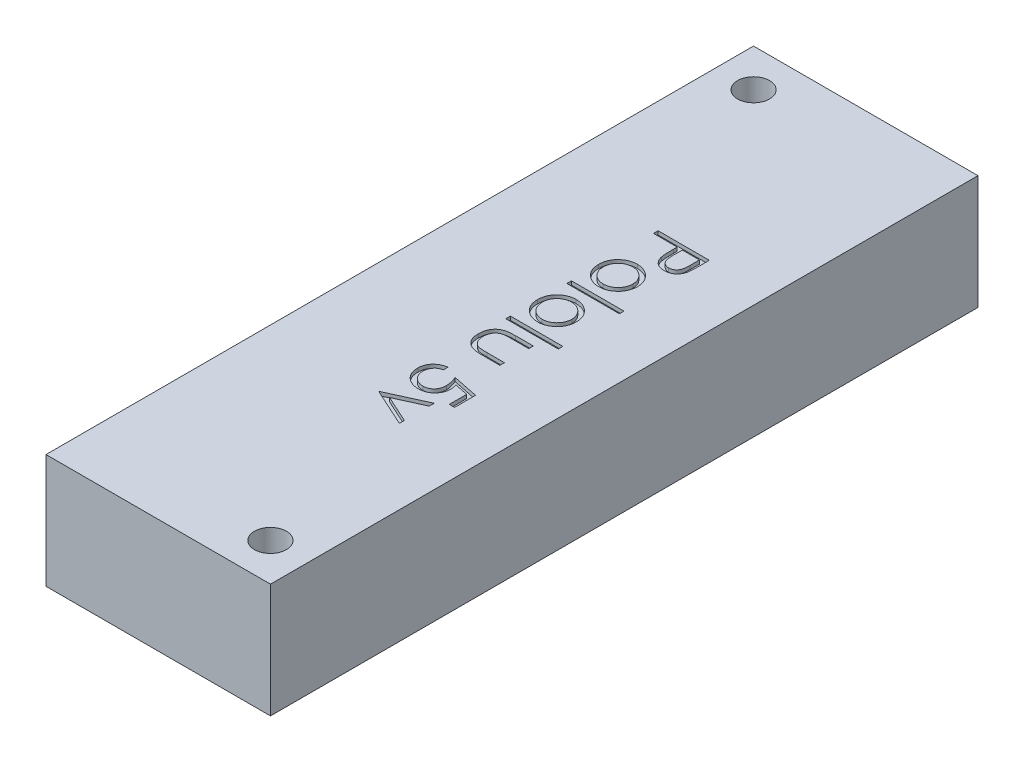
from build123d import *

# Parameters (mm, degrees)
SKETCH1_W           = 15.340000054
SKETCH1_H           = 48.35
BOSS_EXTRUDE1_DEPTH = 7.8
SKETCH3_R           = 1.0922
CUT_EXTRUDE1_DEPTH  = 27.534873759
SKETCH5_W           = 3.58974359
SKETCH5_H           = 0.314102564
CUT_EXTRUDE3_DEPTH  = 0.254


with BuildPart() as part:
    # Sketch1 → Boss-Extrude1 (new body)
    with BuildSketch(Plane(origin=(0, 0, 0), x_dir=(1, 0, 0), z_dir=(0, 1, 0))):
        Rectangle(SKETCH1_W, SKETCH1_H)
    extrude(amount=BOSS_EXTRUDE1_DEPTH)

    # Sketch3 → Cut-Extrude1 (cut, through all)
    with BuildSketch(Plane(origin=(0, 7.8, 0), x_dir=(1, 0, 0), z_dir=(0, 1, 0))):
        with Locations(Location((-5.08, 21.59, 0), (0, 0, 270))):
            Circle(SKETCH3_R)
        with Locations(Location((5.08, -21.59, 0), (0, 0, 270))):
            Circle(SKETCH3_R)
    extrude(amount=-CUT_EXTRUDE1_DEPTH, mode=Mode.SUBTRACT)

    # Sketch5 → Cut-Extrude3 (cut)
    # profile 1 of 8: a face of its own
    with BuildSketch(Plane(origin=(0, 7.8, 0), x_dir=(1, 0, 0), z_dir=(0, 1, 0))):
        with BuildLine():
            Line((3.5, 9.983974359), (3.5, 9.297576122))
            add(Edge.make_bspline(
                [(3.5, 9.297576122), (3.499948104, 9.250365216), (3.499848668, 9.159907023), (3.496833922, 9.030191967), (3.49280723, 8.912382235), (3.487225337, 8.806731855), (3.480628747, 8.712915756), (3.471376708, 8.631358457), (3.461716412, 8.561418901), (3.451895005, 8.519512451), (3.447415865, 8.500400641)],
                knots=[0, 0, 0, 0, 1.415646017, 2.712440637, 3.8905458, 4.950247383, 5.884950622, 6.709939814, 7.411656543, 8, 8, 8, 8], degree=3))
            add(Edge.make_bspline(
                [(3.447415865, 8.500400641), (3.440793975, 8.47620705), (3.42770623, 8.42838996), (3.401491651, 8.359489743), (3.370412659, 8.29393283), (3.334976989, 8.231512612), (3.293734792, 8.172928604), (3.247990678, 8.117430894), (3.197769812, 8.064701161), (3.142098627, 8.016530618), (3.083029703, 7.972183449), (3.019247543, 7.934140306), (2.952140341, 7.901960829), (2.881020836, 7.875679998), (2.806321276, 7.855696428), (2.727823588, 7.840931936), (2.645797497, 7.83148543), (2.589736435, 7.830586047), (2.561197917, 7.830128205)],
                knots=[0, 0, 0, 0, 0.999487232, 1.975422798, 2.933948774, 3.889618007, 4.832992075, 5.786114792, 6.754729845, 7.731954186, 8.717668599, 9.695514499, 10.68728626, 11.680675814, 12.71351902, 13.766008651, 14.862761406, 16, 16, 16, 16], degree=3))
            add(Edge.make_bspline(
                [(2.561197917, 7.830128205), (2.53242014, 7.83054963), (2.476114476, 7.831374176), (2.393741688, 7.841270461), (2.315023298, 7.854600653), (2.240133847, 7.875097705), (2.169518077, 7.901943378), (2.102096845, 7.933435431), (2.039017173, 7.971418961), (1.980050055, 8.015063791), (1.925140143, 8.063615385), (1.874685348, 8.116868324), (1.82898101, 8.174607616), (1.787924666, 8.236649764), (1.752468387, 8.303599613), (1.720711082, 8.374441767), (1.694040021, 8.449791983), (1.68000996, 8.501934497), (1.672876603, 8.528445513)],
                knots=[0, 0, 0, 0, 1.121902311, 2.195077645, 3.232258892, 4.234102512, 5.217864754, 6.176164875, 7.132989551, 8.084763148, 9.034132444, 9.988522005, 10.94243251, 11.903244335, 12.886203696, 13.894208494, 14.929344452, 16, 16, 16, 16], degree=3))
            add(Edge.make_bspline(
                [(1.672876603, 8.528445513), (1.668213621, 8.550372847), (1.657994427, 8.598427874), (1.64658597, 8.677570596), (1.63684837, 8.769715982), (1.629547232, 8.874738262), (1.623296864, 8.992543167), (1.61832877, 9.123194424), (1.615598916, 9.266948502), (1.615458123, 9.367219746), (1.615384615, 9.419571314)],
                knots=[0, 0, 0, 0, 0.601384939, 1.31797006, 2.144135048, 3.087295005, 4.142315834, 5.309527816, 6.595305764, 8, 8, 8, 8], degree=3))
            Line((1.615384615, 9.419571314), (1.615384615, 9.669871795))
            Line((1.615384615, 9.669871795), (0, 9.669871795))
            Line((0, 9.669871795), (0, 9.983974359))
            Line((0, 9.983974359), (3.5, 9.983974359))
        make_face()
        with BuildLine():
            Line((3.141025641, 9.669871795), (1.974358974, 9.669871795))
            Line((1.974358974, 9.669871795), (1.966646635, 9.057091346))
            add(Edge.make_bspline(
                [(1.966646635, 9.057091346), (1.966627924, 9.027171128), (1.966591804, 8.969410763), (1.970631709, 8.885745433), (1.975087995, 8.808322435), (1.982066731, 8.736973633), (1.99126187, 8.672244279), (2.001270604, 8.613302947), (2.014830447, 8.561012507), (2.033737491, 8.499737685), (2.065355346, 8.431690589), (2.112432024, 8.358154058), (2.170792088, 8.294824116), (2.237310672, 8.240387276), (2.311578922, 8.19819887), (2.390418136, 8.166467809), (2.473877922, 8.147984649), (2.530961719, 8.145490569), (2.559795673, 8.144230769)],
                knots=[0, 0, 0, 0, 1.160368111, 2.240066715, 3.248291599, 4.168343349, 5.019594299, 5.784185847, 6.485545725, 7.113397927, 8.269509094, 9.383373363, 10.487084095, 11.595623793, 12.704274681, 13.786671823, 14.88201193, 16, 16, 16, 16], degree=3))
            add(Edge.make_bspline(
                [(2.559795673, 8.144230769), (2.587932, 8.145497297), (2.643863535, 8.148014996), (2.725874557, 8.166613603), (2.803877317, 8.198136928), (2.877231232, 8.240673151), (2.943477588, 8.293546936), (3.000520555, 8.355473427), (3.047000556, 8.425188127), (3.076793746, 8.490071313), (3.095014888, 8.547667384), (3.107758306, 8.597700584), (3.117934363, 8.654190866), (3.126173726, 8.717158766), (3.133227231, 8.786115563), (3.138013195, 8.861653889), (3.140814655, 8.943487529), (3.14095361, 9.0002981), (3.141025641, 9.029747596)],
                knots=[0, 0, 0, 0, 1.120550889, 2.227516482, 3.330715807, 4.461473166, 5.594337325, 6.694900473, 7.802844763, 8.919519911, 9.52614448, 10.208195984, 10.975273469, 11.811520316, 12.738076669, 13.736566072, 14.826679847, 16, 16, 16, 16], degree=3))
            Line((3.141025641, 9.029747596), (3.141025641, 9.669871795))
        make_face(mode=Mode.SUBTRACT)
    # profile 2 of 8: a face of its own
    with BuildSketch(Plane(origin=(0, 7.8, 0), x_dir=(1, 0, 0), z_dir=(0, 1, 0))):
        with BuildLine():
            add(Edge.make_bspline(
                [(2.602564103, 5.966546474), (2.60154521, 5.91855401), (2.599547412, 5.824452517), (2.57808998, 5.686661501), (2.545551155, 5.555267773), (2.499748526, 5.429707695), (2.439653687, 5.311019901), (2.366981145, 5.198144705), (2.281239229, 5.091308256), (2.214875573, 5.027287897), (2.181189904, 4.994791667)],
                knots=[0, 0, 0, 0, 1.054042676, 2.066720093, 3.05716247, 4.025731183, 4.997454851, 5.974904663, 6.97207755, 8, 8, 8, 8], degree=3))
            add(Edge.make_bspline(
                [(2.181189904, 4.994791667), (2.148975918, 4.966809713), (2.085171376, 4.911387332), (1.981715763, 4.840321614), (1.874575662, 4.779100053), (1.762328336, 4.730037092), (1.645953664, 4.691352069), (1.525051653, 4.663886372), (1.399889306, 4.647549438), (1.314885468, 4.645346471), (1.271834936, 4.644230769)],
                knots=[0, 0, 0, 0, 1.025258237, 2.030674902, 3.01204498, 3.988269485, 4.97094183, 5.956517959, 6.965070386, 8, 8, 8, 8], degree=3))
            add(Edge.make_bspline(
                [(1.271834936, 4.644230769), (1.228534878, 4.645212107), (1.142971945, 4.647151275), (1.01695258, 4.665494892), (0.894757754, 4.694025976), (0.776899073, 4.73485782), (0.663016196, 4.787215907), (0.553606839, 4.851106681), (0.448453965, 4.926977963), (0.348454996, 5.012983259), (0.25627808, 5.108030289), (0.175988565, 5.211163987), (0.106912047, 5.320432366), (0.052046085, 5.437327047), (0.007820299, 5.560184074), (-0.022676228, 5.689784892), (-0.041279936, 5.826013887), (-0.043657667, 5.919043343), (-0.044871795, 5.966546474)],
                knots=[0, 0, 0, 0, 0.998669827, 1.973418153, 2.932281609, 3.89081133, 4.846438734, 5.82045571, 6.809776312, 7.834649874, 8.860672198, 9.859676908, 10.845817165, 11.837296335, 12.833502054, 13.853824644, 14.904110009, 16, 16, 16, 16], degree=3))
            add(Edge.make_bspline(
                [(-0.044871795, 5.966546474), (-0.043647621, 6.014280058), (-0.041250016, 6.107768694), (-0.022814613, 6.244510649), (0.008146141, 6.374657127), (0.05149858, 6.498095295), (0.107362699, 6.614989503), (0.175719795, 6.724661357), (0.256318736, 6.8278437), (0.34844398, 6.92292053), (0.448456803, 7.008917836), (0.553606102, 7.08479118), (0.663016387, 7.148681419), (0.776899022, 7.201039645), (0.894757767, 7.241871452), (1.016952576, 7.270402546), (1.142971946, 7.288746161), (1.228534878, 7.290685329), (1.271834936, 7.291666667)],
                knots=[0, 0, 0, 0, 1.099861214, 2.154133753, 3.1731438, 4.178222029, 5.163564916, 6.153006591, 7.15072618, 8.175428628, 9.198983792, 10.187031731, 11.15979573, 12.114193814, 13.071490482, 14.029120454, 15.002614863, 16, 16, 16, 16], degree=3))
            add(Edge.make_bspline(
                [(1.271834936, 7.291666667), (1.314651482, 7.290543356), (1.399420884, 7.288319395), (1.524347945, 7.271998886), (1.645045334, 7.244640329), (1.76097081, 7.205908933), (1.872726246, 7.156393742), (1.980131077, 7.096032454), (2.083118877, 7.024241821), (2.146840957, 6.96903987), (2.179086538, 6.941105769)],
                knots=[0, 0, 0, 0, 1.031353054, 2.041901799, 3.029428768, 4.008703097, 4.981709435, 5.96992636, 6.972712378, 8, 8, 8, 8], degree=3))
            add(Edge.make_bspline(
                [(2.179086538, 6.941105769), (2.213058664, 6.908655841), (2.279870826, 6.844837349), (2.365443569, 6.737507728), (2.439095912, 6.625118081), (2.499160507, 6.50566471), (2.54546805, 6.379755503), (2.578241849, 6.247385231), (2.5994525, 6.109092684), (2.601516565, 6.014535411), (2.602564103, 5.966546474)],
                knots=[0, 0, 0, 0, 1.027951202, 2.021646915, 2.998468564, 3.9668038, 4.943370589, 5.93035926, 6.949632805, 8, 8, 8, 8], degree=3))
        make_face()
        with BuildLine():
            add(Edge.make_bspline(
                [(2.288461538, 5.967948718), (2.287496895, 6.001886291), (2.285592509, 6.068885345), (2.271109357, 6.167505479), (2.24815907, 6.2624436), (2.215565273, 6.353891941), (2.173427645, 6.441496812), (2.121963898, 6.525354603), (2.060899931, 6.605240019), (1.991449449, 6.680539367), (1.916014047, 6.750456766), (1.834897943, 6.810870902), (1.750428202, 6.862337016), (1.662166361, 6.905166387), (1.56927654, 6.93707648), (1.472795205, 6.960248715), (1.372529979, 6.974719168), (1.304368935, 6.976605517), (1.269731571, 6.977564103)],
                knots=[0, 0, 0, 0, 1.021589593, 2.016807015, 2.994807536, 3.958602519, 4.934347097, 5.916793557, 6.916107818, 7.957073844, 8.998039869, 10.008589932, 10.997041759, 11.972786337, 12.956492182, 13.948170289, 14.957322718, 16, 16, 16, 16], degree=3))
            add(Edge.make_bspline(
                [(1.269731571, 6.977564103), (1.224977566, 6.975961519), (1.136149235, 6.97278069), (1.005367193, 6.946783104), (0.879576721, 6.903599903), (0.760292369, 6.84405316), (0.64973484, 6.770719555), (0.550320988, 6.684970944), (0.465884611, 6.585621823), (0.394872197, 6.476055219), (0.338949987, 6.357823832), (0.298846326, 6.23290986), (0.273127506, 6.102450683), (0.270541049, 6.013175087), (0.269230769, 5.967948718)],
                knots=[0, 0, 0, 0, 1.016977094, 2.018509362, 3.018404954, 4.033172147, 5.041280572, 6.028085189, 7.007940189, 7.995502847, 8.989109012, 9.972200833, 10.97273166, 12, 12, 12, 12], degree=3))
            add(Edge.make_bspline(
                [(0.269230769, 5.967948718), (0.270533459, 5.922719748), (0.273104934, 5.833439016), (0.298976626, 5.702798322), (0.338775602, 5.577542001), (0.394935358, 5.459187683), (0.465616203, 5.349571183), (0.550802015, 5.250931483), (0.649473499, 5.164444416), (0.760145777, 5.091038197), (0.879762163, 5.032450918), (1.005344015, 4.989064638), (1.136155138, 4.963129401), (1.224979543, 4.959940157), (1.269731571, 4.958333333)],
                knots=[0, 0, 0, 0, 1.027082318, 2.027431966, 3.015401697, 4.008827937, 4.996211763, 5.971861488, 6.96198607, 7.969911943, 8.982141629, 9.981856156, 10.983207064, 12, 12, 12, 12], degree=3))
            add(Edge.make_bspline(
                [(1.269731571, 4.958333333), (1.3043717, 4.959284786), (1.372538187, 4.9611571), (1.472763828, 4.975729641), (1.569467367, 4.998541916), (1.661792021, 5.031849361), (1.750859277, 5.073208803), (1.834644294, 5.12592689), (1.916065613, 5.18605963), (1.991403982, 5.256105325), (2.061153687, 5.331396196), (2.121741455, 5.411881755), (2.173457034, 5.495778492), (2.215570463, 5.583411049), (2.248033616, 5.674652447), (2.271209332, 5.76930233), (2.285539702, 5.867485728), (2.287481364, 5.934246873), (2.288461538, 5.967948718)],
                knots=[0, 0, 0, 0, 1.043020522, 2.052505155, 3.044509714, 4.030878336, 5.003918577, 5.996372628, 7.007255355, 8.048564058, 9.08987276, 10.095126797, 11.077896669, 12.053962454, 13.01807471, 13.98956039, 14.985105429, 16, 16, 16, 16], degree=3))
        make_face(mode=Mode.SUBTRACT)
    # profile 3 of 8: a face of its own
    with BuildSketch(Plane(origin=(0, 7.8, 0), x_dir=(1, 0, 0), z_dir=(0, 1, 0))):
        with Locations((1.794871795, 3.903846154)):
            Rectangle(SKETCH5_W, SKETCH5_H)
    # profile 4 of 8: a face of its own
    with BuildSketch(Plane(origin=(0, 7.8, 0), x_dir=(1, 0, 0), z_dir=(0, 1, 0))):
        with BuildLine():
            add(Edge.make_bspline(
                [(2.602564103, 1.793469551), (2.60154521, 1.745477087), (2.599547412, 1.651375594), (2.57808998, 1.513584578), (2.545551155, 1.38219085), (2.499748526, 1.256630772), (2.439653687, 1.137942978), (2.366981145, 1.025067781), (2.281239229, 0.918231333), (2.214875573, 0.854210974), (2.181189904, 0.821714744)],
                knots=[0, 0, 0, 0, 1.054042676, 2.066720093, 3.05716247, 4.025731183, 4.997454851, 5.974904663, 6.97207755, 8, 8, 8, 8], degree=3))
            add(Edge.make_bspline(
                [(2.181189904, 0.821714744), (2.148975918, 0.79373279), (2.085171376, 0.738310409), (1.981715763, 0.66724469), (1.874575662, 0.60602313), (1.762328336, 0.556960169), (1.645953664, 0.518275146), (1.525051653, 0.490809449), (1.399889306, 0.474472514), (1.314885468, 0.472269548), (1.271834936, 0.471153846)],
                knots=[0, 0, 0, 0, 1.025258237, 2.030674902, 3.01204498, 3.988269485, 4.97094183, 5.956517959, 6.965070386, 8, 8, 8, 8], degree=3))
            add(Edge.make_bspline(
                [(1.271834936, 0.471153846), (1.228534878, 0.472135183), (1.142971945, 0.474074352), (1.01695258, 0.492417969), (0.894757754, 0.520949053), (0.776899073, 0.561780897), (0.663016196, 0.614138983), (0.553606839, 0.678029758), (0.448453965, 0.75390104), (0.348454996, 0.839906336), (0.25627808, 0.934953366), (0.175988565, 1.038087064), (0.106912047, 1.147355443), (0.052046085, 1.264250124), (0.007820299, 1.387107151), (-0.022676228, 1.516707968), (-0.041279936, 1.652936964), (-0.043657667, 1.74596642), (-0.044871795, 1.793469551)],
                knots=[0, 0, 0, 0, 0.998669827, 1.973418153, 2.932281609, 3.89081133, 4.846438734, 5.82045571, 6.809776312, 7.834649874, 8.860672198, 9.859676908, 10.845817165, 11.837296335, 12.833502054, 13.853824644, 14.904110009, 16, 16, 16, 16], degree=3))
            add(Edge.make_bspline(
                [(-0.044871795, 1.793469551), (-0.043647621, 1.841203135), (-0.041250016, 1.934691771), (-0.022814613, 2.071433726), (0.008146141, 2.201580204), (0.05149858, 2.325018372), (0.107362699, 2.44191258), (0.175719795, 2.551584434), (0.256318736, 2.654766777), (0.34844398, 2.749843607), (0.448456803, 2.835840913), (0.553606102, 2.911714256), (0.663016387, 2.975604496), (0.776899022, 3.027962722), (0.894757767, 3.068794529), (1.016952576, 3.097325623), (1.142971946, 3.115669237), (1.228534878, 3.117608406), (1.271834936, 3.118589744)],
                knots=[0, 0, 0, 0, 1.099861214, 2.154133753, 3.1731438, 4.178222029, 5.163564916, 6.153006591, 7.15072618, 8.175428628, 9.198983792, 10.187031731, 11.15979573, 12.114193814, 13.071490482, 14.029120454, 15.002614863, 16, 16, 16, 16], degree=3))
            add(Edge.make_bspline(
                [(1.271834936, 3.118589744), (1.314651482, 3.117466433), (1.399420884, 3.115242472), (1.524347945, 3.098921963), (1.645045334, 3.071563406), (1.76097081, 3.03283201), (1.872726246, 2.983316819), (1.980131077, 2.922955531), (2.083118877, 2.851164898), (2.146840957, 2.795962947), (2.179086538, 2.768028846)],
                knots=[0, 0, 0, 0, 1.031353054, 2.041901799, 3.029428768, 4.008703097, 4.981709435, 5.96992636, 6.972712378, 8, 8, 8, 8], degree=3))
            add(Edge.make_bspline(
                [(2.179086538, 2.768028846), (2.213058664, 2.735578918), (2.279870826, 2.671760425), (2.365443569, 2.564430805), (2.439095912, 2.452041158), (2.499160507, 2.332587787), (2.54546805, 2.20667858), (2.578241849, 2.074308308), (2.5994525, 1.93601576), (2.601516565, 1.841458488), (2.602564103, 1.793469551)],
                knots=[0, 0, 0, 0, 1.027951202, 2.021646915, 2.998468564, 3.9668038, 4.943370589, 5.93035926, 6.949632805, 8, 8, 8, 8], degree=3))
        make_face()
        with BuildLine():
            add(Edge.make_bspline(
                [(2.288461538, 1.794871795), (2.287496895, 1.828809368), (2.285592509, 1.895808422), (2.271109357, 1.994428556), (2.24815907, 2.089366677), (2.215565273, 2.180815018), (2.173427645, 2.268419889), (2.121963898, 2.35227768), (2.060899931, 2.432163096), (1.991449449, 2.507462444), (1.916014047, 2.577379843), (1.834897943, 2.637793979), (1.750428202, 2.689260093), (1.662166361, 2.732089464), (1.56927654, 2.763999557), (1.472795205, 2.787171792), (1.372529979, 2.801642245), (1.304368935, 2.803528594), (1.269731571, 2.804487179)],
                knots=[0, 0, 0, 0, 1.021589593, 2.016807015, 2.994807536, 3.958602519, 4.934347097, 5.916793557, 6.916107818, 7.957073844, 8.998039869, 10.008589932, 10.997041759, 11.972786337, 12.956492182, 13.948170289, 14.957322718, 16, 16, 16, 16], degree=3))
            add(Edge.make_bspline(
                [(1.269731571, 2.804487179), (1.224977566, 2.802884596), (1.136149235, 2.799703767), (1.005367193, 2.773706181), (0.879576721, 2.73052298), (0.760292369, 2.670976237), (0.64973484, 2.597642632), (0.550320988, 2.511894021), (0.465884611, 2.412544899), (0.394872197, 2.302978296), (0.338949987, 2.184746908), (0.298846326, 2.059832937), (0.273127506, 1.92937376), (0.270541049, 1.840098164), (0.269230769, 1.794871795)],
                knots=[0, 0, 0, 0, 1.016977094, 2.018509362, 3.018404954, 4.033172147, 5.041280572, 6.028085189, 7.007940189, 7.995502847, 8.989109012, 9.972200833, 10.97273166, 12, 12, 12, 12], degree=3))
            add(Edge.make_bspline(
                [(0.269230769, 1.794871795), (0.270533459, 1.749642824), (0.273104934, 1.660362093), (0.298976626, 1.529721399), (0.338775602, 1.404465078), (0.394935358, 1.28611076), (0.465616203, 1.17649426), (0.550802015, 1.07785456), (0.649473499, 0.991367493), (0.760145777, 0.917961274), (0.879762163, 0.859373995), (1.005344015, 0.815987715), (1.136155138, 0.790052478), (1.224979543, 0.786863234), (1.269731571, 0.78525641)],
                knots=[0, 0, 0, 0, 1.027082318, 2.027431966, 3.015401697, 4.008827937, 4.996211763, 5.971861488, 6.96198607, 7.969911943, 8.982141629, 9.981856156, 10.983207064, 12, 12, 12, 12], degree=3))
            add(Edge.make_bspline(
                [(1.269731571, 0.78525641), (1.3043717, 0.786207863), (1.372538187, 0.788080177), (1.472763828, 0.802652717), (1.569467367, 0.825464993), (1.661792021, 0.858772438), (1.750859277, 0.90013188), (1.834644294, 0.952849967), (1.916065613, 1.012982707), (1.991403982, 1.083028402), (2.061153687, 1.158319273), (2.121741455, 1.238804832), (2.173457034, 1.322701569), (2.215570463, 1.410334125), (2.248033616, 1.501575524), (2.271209332, 1.596225407), (2.285539702, 1.694408805), (2.287481364, 1.76116995), (2.288461538, 1.794871795)],
                knots=[0, 0, 0, 0, 1.043020522, 2.052505155, 3.044509714, 4.030878336, 5.003918577, 5.996372628, 7.007255355, 8.048564058, 9.08987276, 10.095126797, 11.077896669, 12.053962454, 13.01807471, 13.98956039, 14.985105429, 16, 16, 16, 16], degree=3))
        make_face(mode=Mode.SUBTRACT)
    # profile 5 of 8: a face of its own
    with BuildSketch(Plane(origin=(0, 7.8, 0), x_dir=(1, 0, 0), z_dir=(0, 1, 0))):
        with Locations((1.794871795, -0.269230769)):
            Rectangle(SKETCH5_W, SKETCH5_H)
    # profile 6 of 8: a face of its own
    with BuildSketch(Plane(origin=(0, 7.8, 0), x_dir=(1, 0, 0), z_dir=(0, 1, 0))):
        with BuildLine():
            Line((2.557692308, -1.099358974), (2.557692308, -1.413461538))
            Line((2.557692308, -1.413461538), (1.371394231, -1.413461538))
            add(Edge.make_bspline(
                [(1.371394231, -1.413461538), (1.336571482, -1.413603443), (1.269957194, -1.413874901), (1.174102007, -1.415715842), (1.086685294, -1.420045935), (1.007656557, -1.42545976), (0.937029166, -1.432421896), (0.875049809, -1.440705256), (0.821015625, -1.449963678), (0.788472269, -1.459026392), (0.77333734, -1.463241186)],
                knots=[0, 0, 0, 0, 1.388932606, 2.656963016, 3.823490214, 4.879454478, 5.816252168, 6.653371382, 7.373723809, 8, 8, 8, 8], degree=3))
            add(Edge.make_bspline(
                [(0.77333734, -1.463241186), (0.754314522, -1.470002685), (0.716664366, -1.483385114), (0.66227459, -1.507657953), (0.611902173, -1.537688688), (0.563587464, -1.570539612), (0.518825676, -1.608472673), (0.477324454, -1.650933222), (0.438599671, -1.697167593), (0.391894487, -1.764891793), (0.342467449, -1.857471615), (0.299224971, -1.978748271), (0.273761575, -2.110485789), (0.270768951, -2.201643393), (0.269230769, -2.248497596)],
                knots=[0, 0, 0, 0, 0.725930277, 1.436768641, 2.137297926, 2.832005607, 3.535753883, 4.242956221, 4.964984144, 5.701683124, 7.198126434, 8.723945959, 10.316137162, 12, 12, 12, 12], degree=3))
            add(Edge.make_bspline(
                [(0.269230769, -2.248497596), (0.270763206, -2.295357737), (0.273720675, -2.3857937), (0.298840522, -2.516154753), (0.339821483, -2.635539872), (0.397828501, -2.742555126), (0.468546589, -2.836528718), (0.551561506, -2.914831162), (0.644209328, -2.979438922), (0.713333816, -3.007648275), (0.748096955, -3.021834936)],
                knots=[0, 0, 0, 0, 1.157091467, 2.233085092, 3.266839029, 4.264239195, 5.228693433, 6.160074799, 7.074690074, 8, 8, 8, 8], degree=3))
            add(Edge.make_bspline(
                [(0.748096955, -3.021834936), (0.762062957, -3.026032268), (0.792938376, -3.035311546), (0.84532423, -3.045210063), (0.907735501, -3.054495875), (0.980827619, -3.060686633), (1.06395603, -3.067752191), (1.157550626, -3.070191947), (1.261059725, -3.073676044), (1.333529294, -3.073703568), (1.371394231, -3.073717949)],
                knots=[0, 0, 0, 0, 0.557560243, 1.232629526, 2.036798082, 2.970922211, 4.03790722, 5.227863888, 6.551574656, 8, 8, 8, 8], degree=3))
            Line((1.371394231, -3.073717949), (2.557692308, -3.073717949))
            Line((2.557692308, -3.073717949), (2.557692308, -3.387820513))
            Line((2.557692308, -3.387820513), (1.3125, -3.387820513))
            add(Edge.make_bspline(
                [(1.3125, -3.387820513), (1.270192828, -3.387378819), (1.188111126, -3.386521873), (1.068827026, -3.381014515), (0.957664743, -3.371564952), (0.854565649, -3.3572221), (0.759607746, -3.340356988), (0.672671696, -3.318598849), (0.594017487, -3.292626835), (0.522291359, -3.263300398), (0.457190155, -3.228751141), (0.395768795, -3.19173186), (0.338129531, -3.150185335), (0.283989051, -3.104479525), (0.233543731, -3.05481971), (0.187013486, -3.000874116), (0.143574873, -2.943724803), (0.104077801, -2.882375469), (0.068870026, -2.816763462), (0.038173414, -2.747218895), (0.012814759, -2.673234465), (-0.007920575, -2.595638957), (-0.025090313, -2.513783029), (-0.036599343, -2.428019631), (-0.043925522, -2.338136455), (-0.044551074, -2.277024987), (-0.044871795, -2.245693109)],
                knots=[0, 0, 0, 0, 1.492959813, 2.896546261, 4.212934643, 5.4282803, 6.568701279, 7.614836728, 8.587629399, 9.489753423, 10.345563548, 11.185732697, 12.018869657, 12.849922188, 13.68387515, 14.5140269, 15.361852057, 16.215154979, 17.085973896, 17.987004002, 18.894652782, 19.842944701, 20.819888734, 21.843945232, 22.894589698, 24, 24, 24, 24], degree=3))
            add(Edge.make_bspline(
                [(-0.044871795, -2.245693109), (-0.044532088, -2.214596595), (-0.043864532, -2.15348905), (-0.036722724, -2.063817806), (-0.024914553, -1.977869199), (-0.008059336, -1.895948801), (0.012979734, -1.817974403), (0.03798327, -1.743630164), (0.069063751, -1.673786601), (0.104041309, -1.607604597), (0.143606584, -1.545602208), (0.186974624, -1.48749363), (0.234080687, -1.433356778), (0.284728044, -1.38317971), (0.33954498, -1.337666733), (0.398090541, -1.296250691), (0.459784629, -1.258293986), (0.525847792, -1.223941196), (0.598419802, -1.19442944), (0.678716899, -1.168374194), (0.767619415, -1.147063556), (0.865051344, -1.129721088), (0.970546385, -1.115769647), (1.084714801, -1.106083505), (1.207278493, -1.100667674), (1.291928383, -1.099804613), (1.335637019, -1.099358974)],
                knots=[0, 0, 0, 0, 1.083640291, 2.129454052, 3.13281866, 4.105697902, 5.042300162, 5.946461698, 6.836384745, 7.703652036, 8.553297018, 9.397182691, 10.228592656, 11.052265423, 11.879314572, 12.708807002, 13.549817954, 14.402308542, 15.300838682, 16.27712199, 17.341985831, 18.484375296, 19.725102775, 21.0496083, 22.476576903, 24, 24, 24, 24], degree=3))
            Line((1.335637019, -1.099358974), (2.557692308, -1.099358974))
        make_face()
    # profile 7 of 8: a face of its own
    with BuildSketch(Plane(origin=(0, 7.8, 0), x_dir=(1, 0, 0), z_dir=(0, 1, 0))):
        with BuildLine():
            Line((3.5, -7.426282051), (3.141025641, -7.426282051))
            Line((3.141025641, -7.426282051), (3.141025641, -6.235777244))
            Line((3.141025641, -6.235777244), (2.220452724, -6.047175481))
            add(Edge.make_bspline(
                [(2.220452724, -6.047175481), (2.230682996, -6.084231355), (2.25050253, -6.156021251), (2.2725083, -6.261981112), (2.285773744, -6.362573315), (2.287585055, -6.427848686), (2.288461538, -6.459435096)],
                knots=[0, 0, 0, 0, 1.100273476, 2.13160584, 3.095893838, 4, 4, 4, 4], degree=3))
            add(Edge.make_bspline(
                [(2.288461538, -6.459435096), (2.287615381, -6.498518701), (2.285951625, -6.575366833), (2.269982922, -6.687807697), (2.244831581, -6.79513363), (2.20975253, -6.897161262), (2.16460626, -6.994110349), (2.108941852, -7.085439483), (2.043144334, -7.171666259), (1.967848539, -7.251650794), (1.884877575, -7.324100217), (1.795958621, -7.388051548), (1.701010796, -7.441238417), (1.600453954, -7.484996053), (1.494456815, -7.519713511), (1.382234792, -7.542884097), (1.264783752, -7.558295665), (1.184479588, -7.560018766), (1.143529647, -7.560897436)],
                knots=[0, 0, 0, 0, 1.052772836, 2.070014431, 3.053871312, 4.019926262, 4.972333346, 5.930471369, 6.896690565, 7.89035727, 8.885779078, 9.861050232, 10.836829716, 11.812751485, 12.812646763, 13.836748493, 14.896881366, 16, 16, 16, 16], degree=3))
            add(Edge.make_bspline(
                [(1.143529647, -7.560897436), (1.11500739, -7.56023245), (1.058348328, -7.558911466), (0.974204676, -7.552191565), (0.891839802, -7.539260734), (0.81125494, -7.52187498), (0.732557826, -7.499398985), (0.655777085, -7.471894682), (0.580676295, -7.439473889), (0.507250538, -7.402870045), (0.437763412, -7.360526182), (0.371142281, -7.315921864), (0.309838941, -7.266512556), (0.251615412, -7.214690413), (0.198758223, -7.15838328), (0.149005388, -7.099338841), (0.104518066, -7.036171469), (0.063599772, -6.970012096), (0.026963122, -6.900902441), (-0.003598389, -6.828141746), (-0.030385817, -6.753327299), (-0.052169495, -6.675792286), (-0.069070481, -6.595686916), (-0.080579823, -6.512735341), (-0.088953871, -6.427353796), (-0.089478555, -6.369478903), (-0.08974359, -6.340244391)],
                knots=[0, 0, 0, 0, 1.05623316, 2.098192244, 3.122504159, 4.140841222, 5.148757784, 6.150489607, 7.158294732, 8.176043417, 9.185147859, 10.169157858, 11.142149047, 12.097904048, 13.0527185, 13.998867679, 14.954465986, 15.910220987, 16.877849176, 17.847023716, 18.829548819, 19.818454515, 20.826519638, 21.858115382, 22.918063636, 24, 24, 24, 24], degree=3))
            add(Edge.make_bspline(
                [(-0.08974359, -6.340244391), (-0.089052691, -6.305370253), (-0.08769343, -6.236759506), (-0.073475808, -6.136238331), (-0.053108741, -6.039525947), (-0.02248395, -5.947387749), (0.015945705, -5.859046365), (0.064206634, -5.775677787), (0.119660638, -5.695643367), (0.184221067, -5.621118347), (0.255448024, -5.552090483), (0.331914473, -5.489350151), (0.413924458, -5.434327255), (0.500779798, -5.386797251), (0.592629943, -5.346313405), (0.689749741, -5.314494507), (0.791650622, -5.288817223), (0.861804012, -5.277953655), (0.897435897, -5.272435897)],
                knots=[0, 0, 0, 0, 1.046825758, 2.059506013, 3.044032586, 4.011925612, 4.970610144, 5.93275819, 6.900651216, 7.891265644, 8.889116719, 9.876966323, 10.858259055, 11.851035124, 12.847502422, 13.86866322, 14.9174643, 16, 16, 16, 16], degree=3))
            Line((0.897435897, -5.272435897), (0.897435897, -5.586538462))
            add(Edge.make_bspline(
                [(0.897435897, -5.586538462), (0.864056261, -5.594262155), (0.799898745, -5.609107522), (0.709809781, -5.641778), (0.629226092, -5.681477427), (0.5580716, -5.729758276), (0.495697109, -5.786186872), (0.439632625, -5.850115623), (0.389723386, -5.922455277), (0.34785381, -6.002809721), (0.312197898, -6.087633441), (0.288442785, -6.176397819), (0.271742785, -6.266702905), (0.270070904, -6.327781176), (0.269230769, -6.358473558)],
                knots=[0, 0, 0, 0, 1.136389429, 2.184203582, 3.172920998, 4.111012962, 5.028380909, 5.957351669, 6.927793475, 7.937618031, 8.960409703, 9.974842029, 10.982339866, 12, 12, 12, 12], degree=3))
            add(Edge.make_bspline(
                [(0.269230769, -6.358473558), (0.270051547, -6.388432002), (0.271667666, -6.447420424), (0.284106678, -6.534231811), (0.303264249, -6.618044685), (0.331934104, -6.698032042), (0.366778822, -6.775593582), (0.411493898, -6.848767352), (0.462953917, -6.919670229), (0.521910547, -6.986098363), (0.586880241, -7.046937812), (0.656357635, -7.100693933), (0.730474481, -7.145470846), (0.807947634, -7.183204955), (0.889626191, -7.211858254), (0.975127366, -7.232299235), (1.064662347, -7.244302294), (1.125731656, -7.245953474), (1.156850962, -7.246794872)],
                knots=[0, 0, 0, 0, 1.027316725, 2.022795036, 3.002884548, 3.971462791, 4.93288096, 5.914575861, 6.907176829, 7.935150275, 8.956128384, 9.956726525, 10.942570165, 11.921478529, 12.907843606, 13.90538589, 14.932640048, 16, 16, 16, 16], degree=3))
            add(Edge.make_bspline(
                [(1.156850962, -7.246794872), (1.18494363, -7.246242452), (1.239962545, -7.245160549), (1.320101712, -7.233137951), (1.396479006, -7.216296157), (1.468411408, -7.19043773), (1.536952265, -7.15848745), (1.600634552, -7.117952365), (1.661094376, -7.071616588), (1.715875584, -7.017344576), (1.766777344, -6.958163255), (1.810106091, -6.892698824), (1.846574147, -6.822444479), (1.878041003, -6.748213338), (1.900642067, -6.66824887), (1.917609863, -6.584132116), (1.927425251, -6.494955442), (1.928787135, -6.433984749), (1.929487179, -6.402644231)],
                knots=[0, 0, 0, 0, 1.045726679, 2.048034203, 3.01323695, 3.95502507, 4.889743367, 5.8246644, 6.761650845, 7.722168973, 8.692072792, 9.66525385, 10.638902184, 11.638179751, 12.663148338, 13.728659964, 14.832472288, 16, 16, 16, 16], degree=3))
            add(Edge.make_bspline(
                [(1.929487179, -6.402644231), (1.928926304, -6.375279708), (1.927778104, -6.319260281), (1.918742011, -6.233130509), (1.904840851, -6.143014908), (1.884804843, -6.048563623), (1.859718381, -5.950035859), (1.828388536, -5.847267761), (1.792300505, -5.740256848), (1.764309399, -5.668230841), (1.75, -5.631410256)],
                knots=[0, 0, 0, 0, 0.824638674, 1.688163388, 2.607705698, 3.571998603, 4.597075385, 5.671199175, 6.809488238, 8, 8, 8, 8], degree=3))
            Line((1.75, -5.631410256), (3.5, -5.990384615))
            Line((3.5, -5.990384615), (3.5, -7.426282051))
        make_face()
    # profile 8 of 8: a face of its own
    with BuildSketch(Plane(origin=(0, 7.8, 0), x_dir=(1, 0, 0), z_dir=(0, 1, 0))):
        Polygon((2.557692308, -7.875), (2.557692308, -8.215044071), (0.695512821, -9.064102564), (2.557692308, -9.913161058), (2.557692308, -10.253205128), (0, -9.086538462), (0, -9.041666667), align=None)
    extrude(amount=-CUT_EXTRUDE3_DEPTH, mode=Mode.SUBTRACT)


solid = part.part
